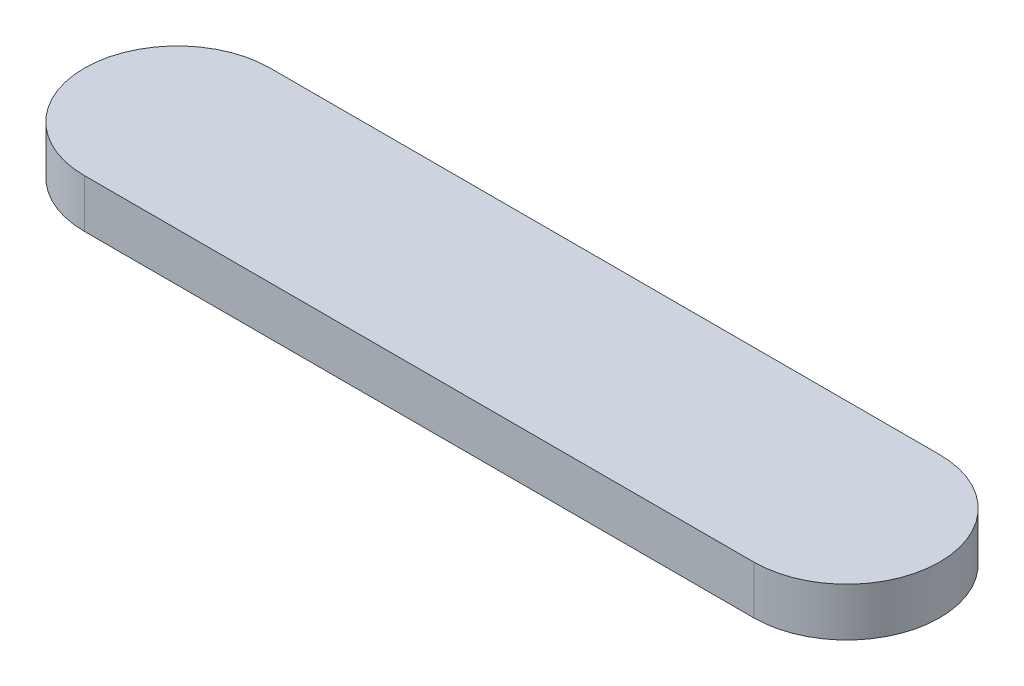
from build123d import *

# Parameters (mm, degrees)
BOSS_EXTRUDE1_DEPTH = 13


with BuildPart() as part:
    # Sketch1 → Boss-Extrude1 (new body)
    with BuildSketch(Plane(origin=(0, 0, 0), x_dir=(1, 0, 0), z_dir=(0, 1, 0))):
        with BuildLine():
            Line((0, 25), (180, 25))
            ThreePointArc((180, 25), (205, 0), (180, -25))
            Line((180, -25), (0, -25))
            ThreePointArc((0, -25), (-25, 0), (0, 25))
        make_face()
    extrude(amount=BOSS_EXTRUDE1_DEPTH)


solid = part.part
